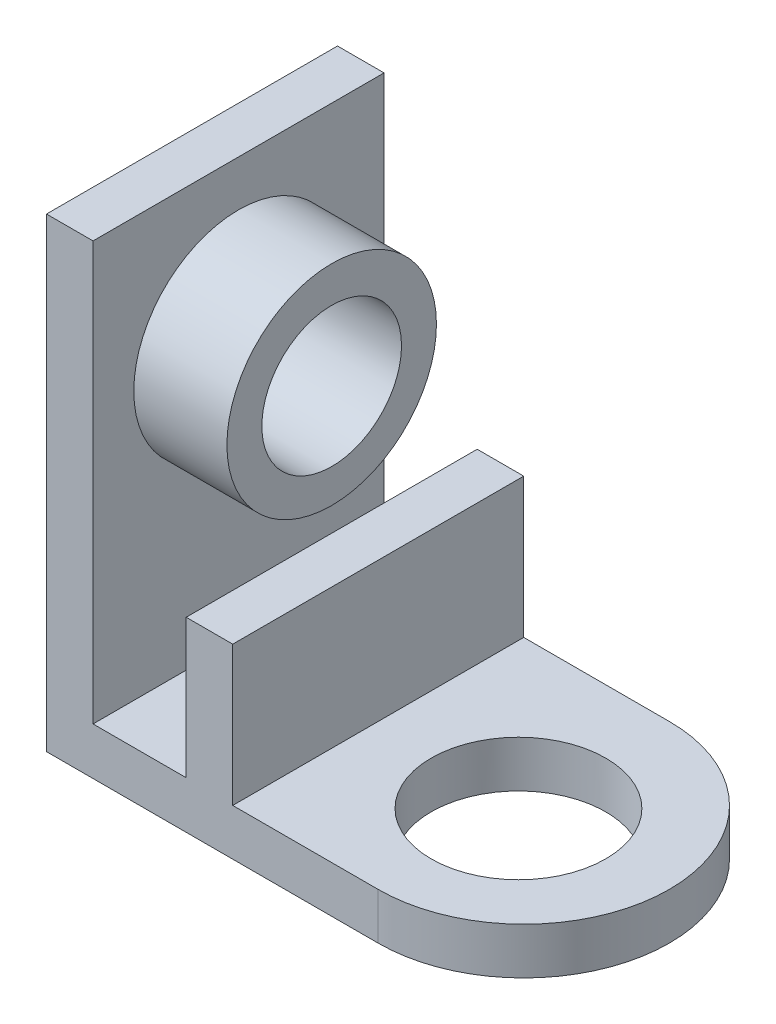
from build123d import *

# Parameters (mm, degrees)
Y_KSEKLIK_EKSTR_ZYON1_DEPTH = 1270
Y_KSEKLIK_EKSTR_ZYON2_DEPTH = 203.2
KES_EKSTR_ZYON1_DEPTH       = 3049.846549107
KES_EKSTR_ZYON1_DEPTH_BACK  = 3049.846549107
IZIM3_R                     = 381
IZIM4_R                     = 457.2
Y_KSEKLIK_EKSTR_ZYON3_DEPTH = 406.4
KES_EKSTR_ZYON2_DEPTH       = 2813.870818221
KES_EKSTR_ZYON2_DEPTH_BACK  = 2813.870818221
IZIM5_R                     = 304.8


with BuildPart() as part:
    # Çizim1 → Yükseklik-Ekstrüzyon1 (new body)
    with BuildSketch(Plane.XY):
        Polygon((0, 2032), (0, 0), (1447.8, 0), (1447.8, 203.2), (812.8, 203.2), (812.8, 812.8), (609.6, 812.8), (609.6, 206.327883969), (203.2, 206.327883969), (203.2, 2032), align=None)
    extrude(amount=Y_KSEKLIK_EKSTR_ZYON1_DEPTH)

    # Çizim2 → Yükseklik-Ekstrüzyon2 (add)
    with BuildSketch(Plane(origin=(0, 203.2, 0), x_dir=(1, 0, 0), z_dir=(0, 1, 0))):
        with BuildLine():
            Line((1447.8, -1270), (1447.8, 0))
            ThreePointArc((1447.8, 0), (2082.8, -635), (1447.8, -1270))
        make_face()
    extrude(amount=-Y_KSEKLIK_EKSTR_ZYON2_DEPTH)

    # Çizim3 → Kes-Ekstrüzyon1 (cut, two sides: drawn at the far end of the back side and taken through both)
    with BuildSketch(Plane(origin=(0, 203.2, 0), x_dir=(1, 0, 0), z_dir=(0, 1, 0)).offset(-KES_EKSTR_ZYON1_DEPTH_BACK)):
        with Locations(Location((1447.8, -658.082587812, 0), (0, 0, 270))):
            Circle(IZIM3_R)
    extrude(amount=KES_EKSTR_ZYON1_DEPTH + KES_EKSTR_ZYON1_DEPTH_BACK, mode=Mode.SUBTRACT)

    # Çizim4 → Yükseklik-Ekstrüzyon3 (add)
    with BuildSketch(Plane(origin=(203.2, 0, 0), x_dir=(0, 0, -1), z_dir=(1, 0, 0))):
        with Locations(Location((-635, 1374.727883969, 0), (0, 0, 180))):
            Circle(IZIM4_R)
    extrude(amount=Y_KSEKLIK_EKSTR_ZYON3_DEPTH)

    # Çizim5 → Kes-Ekstrüzyon2 (cut, two sides: drawn at the far end of the back side and taken through both)
    with BuildSketch(Plane(origin=(609.6, 0, 0), x_dir=(0, 0, -1), z_dir=(1, 0, 0)).offset(-KES_EKSTR_ZYON2_DEPTH_BACK)):
        with Locations((-635, 1369.517370068)):
            Circle(IZIM5_R)
    extrude(amount=KES_EKSTR_ZYON2_DEPTH + KES_EKSTR_ZYON2_DEPTH_BACK, mode=Mode.SUBTRACT)


solid = part.part
